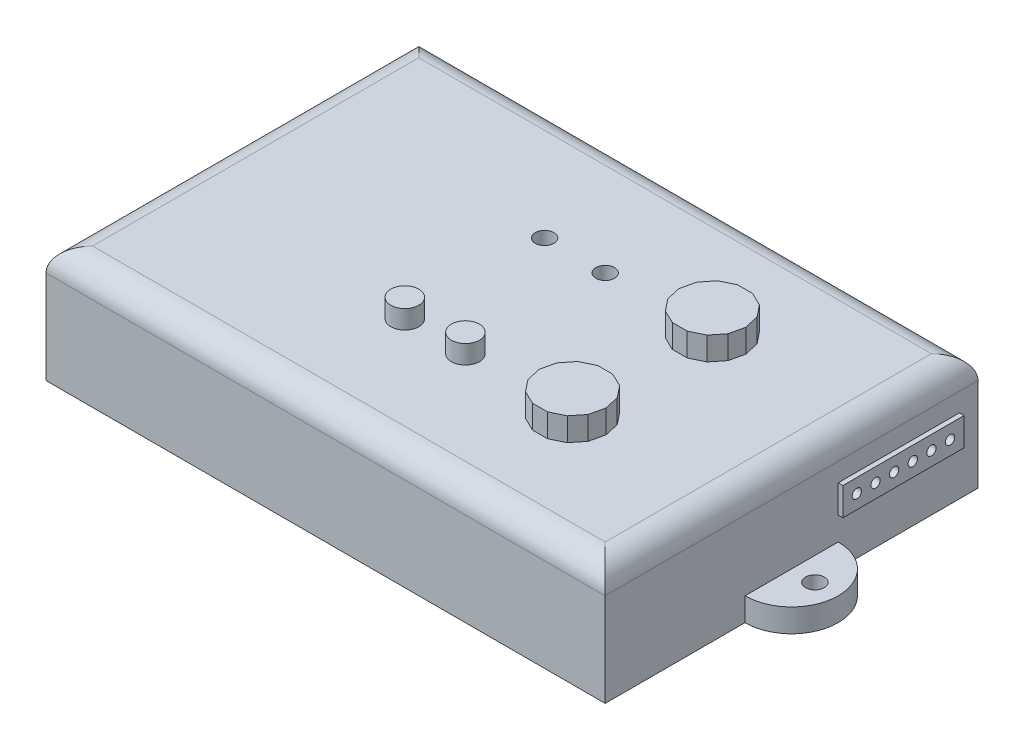
from build123d import *

# Parameters (mm, degrees)
BOSS_EXTRUDE2_DEPTH      = 20
CUT_EXTRUDE1_START       = -15
CUT_EXTRUDE1_DEPTH       = 15
SKETCH4_W                = 114
SKETCH4_H                = 74
CUT_EXTRUDE2_DEPTH       = 15
SKETCH5_R                = 2
CUT_EXTRUDE3_DEPTH       = 154.948043183
BOSS_EXTRUDE3_DEPTH      = 1
BOSS_EXTRUDE3_DEPTH_BACK = 6
SKETCH8_W                = 26
SKETCH8_H                = 6
CUT_EXTRUDE4_DEPTH       = 2
CUT_EXTRUDE4_DEPTH_BACK  = 35
SKETCH6_R                = 1
SKETCH10_R               = 2
BOSS_EXTRUDE4_DEPTH      = 15
SKETCH11_R               = 1.5
CUT_EXTRUDE5_DEPTH       = 15
SKETCH12_W               = 80
SKETCH12_H               = 5
BOSS_EXTRUDE5_DEPTH      = 120
FILLET1_R                = 5
BOSS_EXTRUDE6_DEPTH      = 5
SKETCH14_R               = 3
BOSS_EXTRUDE7_DEPTH      = 4
SKETCH15_R               = 2
CUT_EXTRUDE6_DEPTH       = 10
SKETCH16_W               = 12
SKETCH16_H               = 8
CUT_EXTRUDE7_DEPTH       = 1
SKETCH17_W               = 10
SKETCH17_H               = 6
CUT_EXTRUDE8_DEPTH       = 4


with BuildPart() as part:
    # Sketch2 → Boss-Extrude2 (new body)
    with BuildSketch(Plane(origin=(0, 0, 0), x_dir=(1, 0, 0), z_dir=(0, 1, 0))):
        Polygon((0, 80), (0, 50), (0, 30), (0, 0), (120, 0), (120, 30), (120, 50), (120, 80), align=None)
        with BuildLine():
            ThreePointArc((0, 30), (-10, 40), (0, 50))
            Line((0, 50), (0, 30))
        make_face()
        with BuildLine():
            ThreePointArc((120, 30), (130, 40), (120, 50))
            Line((120, 50), (120, 30))
        make_face()
    extrude(amount=BOSS_EXTRUDE2_DEPTH)

    # Sketch3 → Cut-Extrude1 (cut)
    with BuildSketch(Plane(origin=(0, 20, 0), x_dir=(1, 0, 0), z_dir=(0, 1, 0)).offset(CUT_EXTRUDE1_START)):
        with BuildLine():
            Line((0, 50), (0, 30))
            ThreePointArc((0, 30), (-10, 40), (0, 50))
        make_face()
        with BuildLine():
            Line((120, 50), (120, 30))
            ThreePointArc((120, 30), (130, 40), (120, 50))
        make_face()
    extrude(amount=CUT_EXTRUDE1_DEPTH, mode=Mode.SUBTRACT)

    # Sketch4 → Cut-Extrude2 (cut)
    with BuildSketch(Plane(origin=(0, 20, 0), x_dir=(1, 0, 0), z_dir=(0, 1, 0))):
        with Locations((60, 40)):
            Rectangle(SKETCH4_W, SKETCH4_H)
    extrude(amount=-CUT_EXTRUDE2_DEPTH, mode=Mode.SUBTRACT)

    # Sketch5 → Cut-Extrude3 (cut, through all)
    with BuildSketch(Plane.XZ):
        with Locations(Location((-5, -40, 0), (0, 0, 270))):
            Circle(SKETCH5_R)
        with Locations(Location((125, -40, 0), (0, 0, 270))):
            Circle(SKETCH5_R)
    extrude(amount=-CUT_EXTRUDE3_DEPTH, mode=Mode.SUBTRACT)

    # Sketch8 → Boss-Extrude3 (add, two sides: drawn at the far end of the back side and taken through both)
    with BuildSketch(Plane(origin=(120, 0, 0), x_dir=(0, 0, -1), z_dir=(1, 0, 0)).offset(-BOSS_EXTRUDE3_DEPTH_BACK)):
        with Locations((63, 13)):
            Rectangle(SKETCH8_W, SKETCH8_H)
    extrude(amount=BOSS_EXTRUDE3_DEPTH + BOSS_EXTRUDE3_DEPTH_BACK)

    # Sketch6 → Cut-Extrude4 (cut, two sides: drawn at the far end of the back side and taken through both)
    with BuildSketch(Plane(origin=(120, 0, 0), x_dir=(0, 0, -1), z_dir=(1, 0, 0)).offset(-CUT_EXTRUDE4_DEPTH_BACK)):
        with Locations(Location((73, 13, 0), (0, 0, 180))):
            Circle(SKETCH6_R)
        with Locations(Location((57, 13, 0), (0, 0, 180))):
            Circle(SKETCH6_R)
        with Locations(Location((53, 13, 0), (0, 0, 180))):
            Circle(SKETCH6_R)
        with Locations(Location((65, 13, 0), (0, 0, 180))):
            Circle(SKETCH6_R)
        with Locations(Location((61, 13, 0), (0, 0, 180))):
            Circle(SKETCH6_R)
        with Locations(Location((69, 13, 0), (0, 0, 180))):
            Circle(SKETCH6_R)
    extrude(amount=CUT_EXTRUDE4_DEPTH + CUT_EXTRUDE4_DEPTH_BACK, mode=Mode.SUBTRACT)

    # Sketch10 → Boss-Extrude4 (add)
    with BuildSketch(Plane(origin=(0, 5, 0), x_dir=(1, 0, 0), z_dir=(0, 1, 0))):
        with Locations(Location((12, 69.718295326, 0), (0, 0, 270))):
            Circle(SKETCH10_R)
        with Locations(Location((12, 11, 0), (0, 0, 270))):
            Circle(SKETCH10_R)
        with Locations(Location((103, 69, 0), (0, 0, 270))):
            Circle(SKETCH10_R)
        with Locations(Location((103, 11, 0), (0, 0, 270))):
            Circle(SKETCH10_R)
    extrude(amount=BOSS_EXTRUDE4_DEPTH)

    # Sketch11 → Cut-Extrude5 (cut)
    with BuildSketch(Plane(origin=(0, 20, 0), x_dir=(1, 0, 0), z_dir=(0, 1, 0))):
        with Locations(Location((12, 69.718295326, 0), (0, 0, 270))):
            Circle(SKETCH11_R)
        with Locations(Location((103, 69, 0), (0, 0, 270))):
            Circle(SKETCH11_R)
        with Locations(Location((12, 11, 0), (0, 0, 270))):
            Circle(SKETCH11_R)
        with Locations(Location((103, 11, 0), (0, 0, 270))):
            Circle(SKETCH11_R)
    extrude(amount=-CUT_EXTRUDE5_DEPTH, mode=Mode.SUBTRACT)

    # Sketch12 → Boss-Extrude5 (add)
    with BuildSketch(Plane.ZY):
        with Locations((-40, 22.5)):
            Rectangle(SKETCH12_W, SKETCH12_H)
    extrude(amount=-BOSS_EXTRUDE5_DEPTH)

    # Fillet1
    fillet1_edges = [part.edges().sort_by_distance(p)[0] for p in [
        (120, 25, -40),
        (60, 25, -80),
        (60, 25, 0),
        (0, 25, -40),
    ]]
    fillet(fillet1_edges, radius=FILLET1_R)

    # Sketch13 → Boss-Extrude6 (add)
    with BuildSketch(Plane(origin=(0, 25, 0), x_dir=(1, 0, 0), z_dir=(0, 1, 0))):
        Polygon((81.531027272, 58.115293075), (80.819981957, 55), (81.531027272, 51.884706925), (83.523331973, 49.386435849), (86.402295679, 48), (89.597704321, 48), (92.476668027, 49.386435849), (94.468972728, 51.884706925), (95.180018043, 55), (94.468972728, 58.115293075), (92.476668027, 60.613564151), (89.597704321, 62), (86.402295679, 62), (83.523331973, 60.613564151), align=None)
        Polygon((95.180018043, 25), (94.468972728, 28.115293075), (92.476668027, 30.613564151), (89.597704321, 32), (86.402295679, 32), (83.523331973, 30.613564151), (81.531027272, 28.115293075), (80.819981957, 25), (81.531027272, 21.884706925), (83.523331973, 19.386435849), (86.402295679, 18), (89.597704321, 18), (92.476668027, 19.386435849), (94.468972728, 21.884706925), align=None)
    extrude(amount=BOSS_EXTRUDE6_DEPTH)

    # Sketch14 → Boss-Extrude7 (add)
    with BuildSketch(Plane(origin=(0, 25, 0), x_dir=(1, 0, 0), z_dir=(0, 1, 0))):
        with Locations(Location((52, 25, 0), (0, 0, 270))):
            Circle(SKETCH14_R)
        with Locations(Location((65, 25, 0), (0, 0, 270))):
            Circle(SKETCH14_R)
    extrude(amount=BOSS_EXTRUDE7_DEPTH)

    # Sketch15 → Cut-Extrude6 (cut)
    with BuildSketch(Plane(origin=(0, 25, 0), x_dir=(1, 0, 0), z_dir=(0, 1, 0))):
        with Locations(Location((52, 55, 0), (0, 0, 270))):
            Circle(SKETCH15_R)
        with Locations(Location((65, 55, 0), (0, 0, 270))):
            Circle(SKETCH15_R)
    extrude(amount=-CUT_EXTRUDE6_DEPTH, mode=Mode.SUBTRACT)

    # Sketch16 → Cut-Extrude7 (cut)
    with BuildSketch(Plane.ZY):
        with Locations((-66, 10)):
            Rectangle(SKETCH16_W, SKETCH16_H)
    extrude(amount=-CUT_EXTRUDE7_DEPTH, mode=Mode.SUBTRACT)

    # Sketch17 → Cut-Extrude8 (cut)
    with BuildSketch(Plane.ZY.offset(-1)):
        with Locations((-66, 10)):
            Rectangle(SKETCH17_W, SKETCH17_H)
    extrude(amount=-CUT_EXTRUDE8_DEPTH, mode=Mode.SUBTRACT)


solid = part.part
